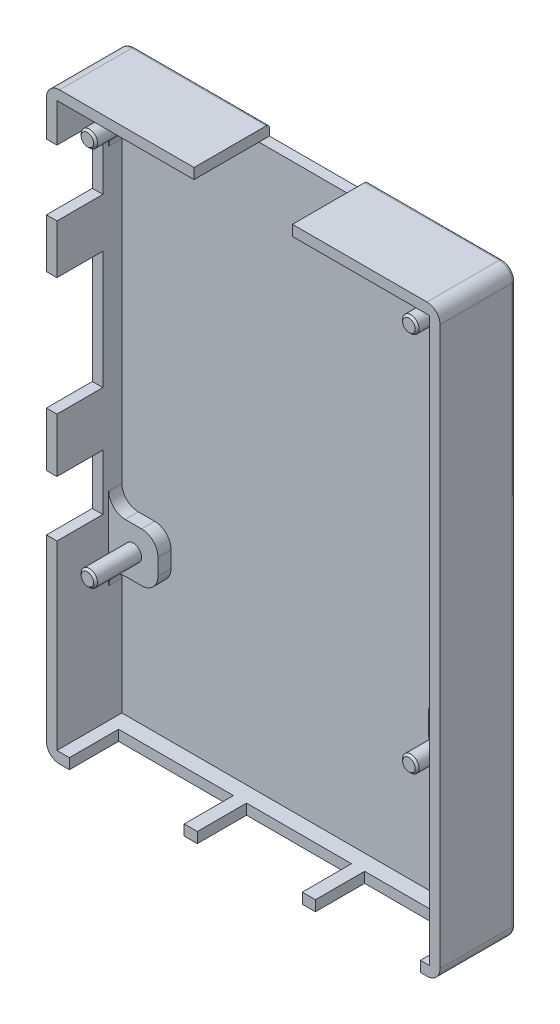
from build123d import *

# Parameters (mm, degrees)
ESQUISSE1_W              = 60
ESQUISSE1_H              = 89
BOSS_EXTRU_1_DEPTH       = 11.5
ESQUISSE2_W              = 15
ESQUISSE2_H              = 1.6
ENL_V_MAT_EXTRU_1_DEPTH  = 55.886246
ENL_V_MAT_EXTRU_2_REACH  = 94.584
ESQUISSE4_W              = 15
ESQUISSE4_H              = 9.9
ENL_V_MAT_EXTRU_3_REACH  = 75.647
ESQUISSE5_W              = 85.8
ESQUISSE5_H              = 9.9
ENL_V_MAT_EXTRU_4_REACH  = 75.647
ESQUISSE6_W              = 9.9
ESQUISSE6_H              = 85.8
ENL_V_MAT_EXTRU_5_REACH  = 76.922
ESQUISSE7_W              = 7
ESQUISSE7_H              = 10
ENL_V_MAT_EXTRU_6_REACH  = 76.922
ESQUISSE8_W              = 7
ESQUISSE8_H              = 18
ENL_V_MAT_EXTRU_7_REACH  = 96.096
ESQUISSE9_W              = 17.5
ESQUISSE9_H              = 7.5
ENL_V_MAT_EXTRU_8_REACH  = 96.096
ESQUISSE10_W             = 16
ESQUISSE10_H             = 7.5
ENL_V_MAT_EXTRU_9_REACH  = 96.096
ESQUISSE11_W             = 16
ESQUISSE11_H             = 7.5
ENL_V_MAT_EXTRU_10_REACH = 76.922
ESQUISSE12_W             = 7
ESQUISSE12_H             = 8.5
ESQUISSE23_W             = 2
ESQUISSE23_H             = 7.5
BOSS_EXTRU_5_DEPTH       = 7.5
ESQUISSE24_W             = 7.5
ESQUISSE24_H             = 2
BOSS_EXTRU_6_DEPTH       = 7.5
ESQUISSE25_W             = 2
ESQUISSE25_H             = 7.5
BOSS_EXTRU_7_DEPTH       = 8.1
ESQUISSE26_W             = 2
ESQUISSE26_H             = 7.5
BOSS_EXTRU_8_DEPTH       = 7.5
ESQUISSE28_W             = 1.25
ESQUISSE28_H             = 7
ESQUISSE29_W             = 1.25
ESQUISSE29_H             = 7
ESQUISSE30_W             = 1.25
ESQUISSE30_H             = 7
ESQUISSE31_W             = 1.25
ESQUISSE31_H             = 7
CONG_1_R                 = 2
CHANFREIN1_SIZE          = 0.3
CONG_2_R                 = 0.5
CONG_9_R                 = 2.5


with BuildPart() as part:
    # Esquisse1 → Boss.-Extru.1 (new body)
    with BuildSketch(Plane.XY.offset(5.75)):
        Rectangle(ESQUISSE1_W, ESQUISSE1_H)
    extrude(amount=-BOSS_EXTRU_1_DEPTH)

    # Esquisse2 → Enlèv. mat.-Extru.1 (cut, through all)
    with BuildSketch(Plane(origin=(0, 0, -5.75), x_dir=(-1, 0, 0), z_dir=(0, 0, -1))):
        with Locations((0, 43.7)):
            Rectangle(ESQUISSE2_W, ESQUISSE2_H)
    extrude(amount=-ENL_V_MAT_EXTRU_1_DEPTH, mode=Mode.SUBTRACT)

    # Esquisse4 → Enlèv. mat.-Extru.2 (cut, up to next)
    with BuildSketch(Plane.XZ.offset(42.9), mode=Mode.PRIVATE) as enl_v_mat_extru_2_sk1:
        with Locations((0, 0.8)):
            Rectangle(ESQUISSE4_W, ESQUISSE4_H)
    enl_v_mat_extru_2_tool1 = extrude(enl_v_mat_extru_2_sk1.sketch, amount=-ENL_V_MAT_EXTRU_2_REACH, mode=Mode.PRIVATE) & part.part
    add(enl_v_mat_extru_2_tool1.solids().sort_by_distance((0, -42.9, 0.8))[0], mode=Mode.SUBTRACT)

    # Esquisse5 → Enlèv. mat.-Extru.3 (cut, up to next)
    with BuildSketch(Plane(origin=(-28.4, 0, 0), x_dir=(0, -1, 0), z_dir=(-1, 0, 0)), mode=Mode.PRIVATE) as enl_v_mat_extru_3_sk1:
        with Locations((0, 0.8)):
            Rectangle(ESQUISSE5_W, ESQUISSE5_H)
    enl_v_mat_extru_3_tool1 = extrude(enl_v_mat_extru_3_sk1.sketch, amount=-ENL_V_MAT_EXTRU_3_REACH, mode=Mode.PRIVATE) & part.part
    add(enl_v_mat_extru_3_tool1.solids().sort_by_distance((-28.4, 0, 0.8))[0], mode=Mode.SUBTRACT)

    # Esquisse6 → Enlèv. mat.-Extru.4 (cut, up to next)
    with BuildSketch(Plane(origin=(28.4, 0, 0), x_dir=(0, 0, -1), z_dir=(1, 0, 0)), mode=Mode.PRIVATE) as enl_v_mat_extru_4_sk1:
        with Locations((-0.8, 0)):
            Rectangle(ESQUISSE6_W, ESQUISSE6_H)
    enl_v_mat_extru_4_tool1 = extrude(enl_v_mat_extru_4_sk1.sketch, amount=-ENL_V_MAT_EXTRU_4_REACH, mode=Mode.PRIVATE) & part.part
    add(enl_v_mat_extru_4_tool1.solids().sort_by_distance((28.4, 0, 0.8))[0], mode=Mode.SUBTRACT)

    # Esquisse7 → Enlèv. mat.-Extru.5 (cut, up to next)
    with BuildSketch(Plane.ZY.offset(30), mode=Mode.PRIVATE) as enl_v_mat_extru_5_sk1:
        with Locations((2.25, 32)):
            Rectangle(ESQUISSE7_W, ESQUISSE7_H)
    enl_v_mat_extru_5_tool1 = extrude(enl_v_mat_extru_5_sk1.sketch, amount=-ENL_V_MAT_EXTRU_5_REACH, mode=Mode.PRIVATE) & part.part
    add(enl_v_mat_extru_5_tool1.solids().sort_by_distance((-30, 32, 2.25))[0], mode=Mode.SUBTRACT)

    # Esquisse8 → Enlèv. mat.-Extru.6 (cut, up to next)
    with BuildSketch(Plane.ZY.offset(30), mode=Mode.PRIVATE) as enl_v_mat_extru_6_sk1:
        with Locations((2.25, 10.5)):
            Rectangle(ESQUISSE8_W, ESQUISSE8_H)
    enl_v_mat_extru_6_tool1 = extrude(enl_v_mat_extru_6_sk1.sketch, amount=-ENL_V_MAT_EXTRU_6_REACH, mode=Mode.PRIVATE) & part.part
    add(enl_v_mat_extru_6_tool1.solids().sort_by_distance((-30, 10.5, 2.25))[0], mode=Mode.SUBTRACT)

    # Esquisse9 → Enlèv. mat.-Extru.7 (cut, up to next)
    with BuildSketch(Plane.XZ.offset(44.5), mode=Mode.PRIVATE) as enl_v_mat_extru_7_sk1:
        with Locations((-17.75, 2)):
            Rectangle(ESQUISSE9_W, ESQUISSE9_H)
    enl_v_mat_extru_7_tool1 = extrude(enl_v_mat_extru_7_sk1.sketch, amount=-ENL_V_MAT_EXTRU_7_REACH, mode=Mode.PRIVATE) & part.part
    add(enl_v_mat_extru_7_tool1.solids().sort_by_distance((-17.75, -44.5, 2))[0], mode=Mode.SUBTRACT)

    # Esquisse10 → Enlèv. mat.-Extru.8 (cut, up to next)
    with BuildSketch(Plane.XZ.offset(44.5), mode=Mode.PRIVATE) as enl_v_mat_extru_8_sk1:
        with Locations((1, 2)):
            Rectangle(ESQUISSE10_W, ESQUISSE10_H)
    enl_v_mat_extru_8_tool1 = extrude(enl_v_mat_extru_8_sk1.sketch, amount=-ENL_V_MAT_EXTRU_8_REACH, mode=Mode.PRIVATE) & part.part
    add(enl_v_mat_extru_8_tool1.solids().sort_by_distance((1, -44.5, 2))[0], mode=Mode.SUBTRACT)

    # Esquisse11 → Enlèv. mat.-Extru.9 (cut, up to next)
    with BuildSketch(Plane.XZ.offset(44.5), mode=Mode.PRIVATE) as enl_v_mat_extru_9_sk1:
        with Locations((19, 2)):
            Rectangle(ESQUISSE11_W, ESQUISSE11_H)
    enl_v_mat_extru_9_tool1 = extrude(enl_v_mat_extru_9_sk1.sketch, amount=-ENL_V_MAT_EXTRU_9_REACH, mode=Mode.PRIVATE) & part.part
    add(enl_v_mat_extru_9_tool1.solids().sort_by_distance((19, -44.5, 2))[0], mode=Mode.SUBTRACT)

    # Esquisse12 → Enlèv. mat.-Extru.10 (cut, up to next)
    with BuildSketch(Plane.ZY.offset(30), mode=Mode.PRIVATE) as enl_v_mat_extru_10_sk1:
        with Locations((2.25, -11)):
            Rectangle(ESQUISSE12_W, ESQUISSE12_H)
    enl_v_mat_extru_10_tool1 = extrude(enl_v_mat_extru_10_sk1.sketch, amount=-ENL_V_MAT_EXTRU_10_REACH, mode=Mode.PRIVATE) & part.part
    add(enl_v_mat_extru_10_tool1.solids().sort_by_distance((-30, -11, 2.25))[0], mode=Mode.SUBTRACT)

    # Esquisse23 → Boss.-Extru.5 (add)
    with BuildSketch(Plane(origin=(-28.4, 0, 0), x_dir=(0, 0, -1), z_dir=(1, 0, 0))):
        with Locations((3.15, 39.15)):
            Rectangle(ESQUISSE23_W, ESQUISSE23_H)
    extrude(amount=BOSS_EXTRU_5_DEPTH)

    # Esquisse24 → Boss.-Extru.6 (add)
    with BuildSketch(Plane.XZ.offset(-42.9)):
        with Locations((24.65, -3.15)):
            Rectangle(ESQUISSE24_W, ESQUISSE24_H)
    extrude(amount=BOSS_EXTRU_6_DEPTH)

    # Esquisse25 → Boss.-Extru.7 (add)
    with BuildSketch(Plane.ZY.offset(-28.4)):
        with Locations((-3.15, -18.85)):
            Rectangle(ESQUISSE25_W, ESQUISSE25_H)
    extrude(amount=BOSS_EXTRU_7_DEPTH)

    # Esquisse26 → Boss.-Extru.8 (add)
    with BuildSketch(Plane(origin=(-28.4, 0, 0), x_dir=(0, 0, -1), z_dir=(1, 0, 0))):
        with Locations((3.15, -18.85)):
            Rectangle(ESQUISSE26_W, ESQUISSE26_H)
    extrude(amount=BOSS_EXTRU_8_DEPTH)

    # Esquisse28 → Révolution1 (revolve)
    with BuildSketch(Plane(origin=(0, -18.85, 0), x_dir=(1, 0, 0), z_dir=(0, 1, 0))):
        with Locations((24.975, -1.35)):
            Rectangle(ESQUISSE28_W, ESQUISSE28_H)
    revolve(axis=Axis((24.35, -18.85, -2.15), (0, 0, 1)))

    # Esquisse29 → Révolution2 (revolve)
    with BuildSketch(Plane(origin=(0, 39.15, 0), x_dir=(1, 0, 0), z_dir=(0, 1, 0))):
        with Locations((24.975, -1.35)):
            Rectangle(ESQUISSE29_W, ESQUISSE29_H)
    revolve(axis=Axis((24.35, 39.15, -2.15), (0, 0, 1)))

    # Esquisse30 → Révolution3 (revolve)
    with BuildSketch(Plane(origin=(0, 39.15, 0), x_dir=(1, 0, 0), z_dir=(0, 1, 0))):
        with Locations((-24.025, -1.35)):
            Rectangle(ESQUISSE30_W, ESQUISSE30_H)
    revolve(axis=Axis((-24.65, 39.15, -2.15), (0, 0, 1)))

    # Esquisse31 → Révolution4 (revolve)
    with BuildSketch(Plane(origin=(0, -18.85, 0), x_dir=(1, 0, 0), z_dir=(0, 1, 0))):
        with Locations((-24.025, -1.35)):
            Rectangle(ESQUISSE31_W, ESQUISSE31_H)
    revolve(axis=Axis((-24.65, -18.85, -2.15), (0, 0, 1)))

    # Congé1
    cong_1_edges = [part.edges().sort_by_distance(p)[0] for p in [
        (30, -44.5, 0),
        (-30, -44.5, 0),
        (-30, 44.5, 0),
        (30, 44.5, 0),
    ]]
    fillet(cong_1_edges, radius=CONG_1_R)

    # Chanfrein1
    chanfrein1_edges = [part.edges().sort_by_distance(p)[0] for p in [
        (23.1, -18.85, 4.85),
        (23.1, 39.15, 4.85),
        (-25.9, 39.15, 4.85),
        (-25.9, -18.85, 4.85),
    ]]
    chamfer(chanfrein1_edges, length=CHANFREIN1_SIZE)

    # Congé2
    cong_2_edges = [part.edges().sort_by_distance(p)[0] for p in [
        (-17.75, 44.5, -5.75),
        (30, 0, -5.75),
        (17.75, 44.5, -5.75),
        (0, -44.5, -5.75),
        (-30, 0, -5.75),
        (-29.414213562, -43.914213562, -5.75),
        (29.414213562, -43.914213562, -5.75),
        (-29.414213562, 43.914213562, -5.75),
        (29.414213562, 43.914213562, -5.75),
    ]]
    fillet(cong_2_edges, radius=CONG_2_R)

    # Congé9
    cong_9_edges = [part.edges().sort_by_distance(p)[0] for p in [
        (-28.4, 35.4, -3.15),
        (-20.9, 35.4, -3.15),
        (-20.9, 42.9, -3.15),
        (20.9, 42.9, -3.15),
        (20.9, 35.4, -3.15),
        (28.4, 35.4, -3.15),
        (28.4, -22.6, -3.15),
        (28.4, -15.1, -3.15),
        (20.3, -22.6, -3.15),
        (20.3, -15.1, -3.15),
        (-28.4, -22.6, -3.15),
        (-28.4, -15.1, -3.15),
        (-20.9, -22.6, -3.15),
        (-20.9, -15.1, -3.15),
    ]]
    fillet(cong_9_edges, radius=CONG_9_R)


solid = part.part
